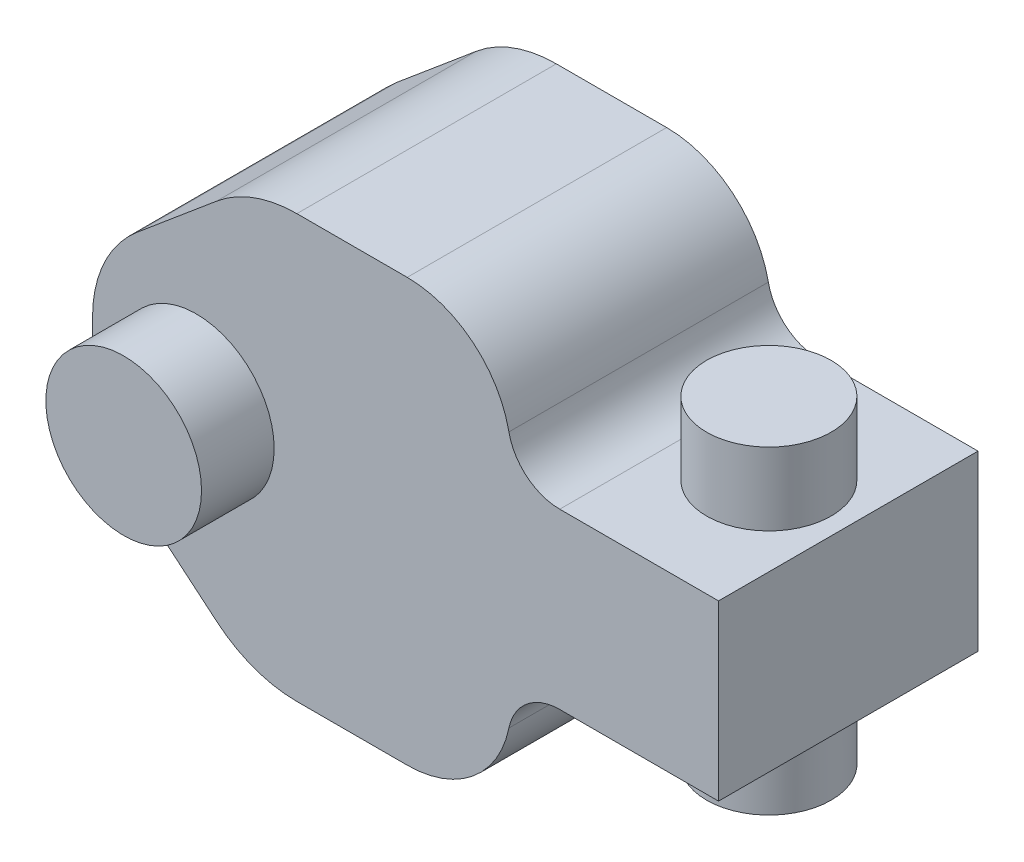
from build123d import *

# Parameters (mm, degrees)
SALIENTE_EXTRUIR1_DEPTH = 12.5
CROQUIS3_R              = 7.5
SALIENTE_EXTRUIR2_DEPTH = 19.5
CROQUIS4_W              = 20
CROQUIS4_H              = 25
CORTAR_EXTRUIR1_DEPTH   = 12
CROQUIS5_W              = 20
CROQUIS5_H              = 25
CORTAR_EXTRUIR2_DEPTH   = 12
REDONDEO1_R             = 10
REDONDEO2_R             = 5
CROQUIS7_R              = 6
SALIENTE_EXTRUIR4_DEPTH = 7
SALIENTE_EXTRUIR5_START = 7
CROQUIS8_R              = 6
SALIENTE_EXTRUIR5_DEPTH = 7


with BuildPart() as part:
    # Croquis1 → Saliente-Extruir1 (new, symmetric)
    with BuildSketch(Plane.XY):
        with BuildLine():
            Line((4.147680169, -1.57927741), (-36.48467702, -1.57927741))
            ThreePointArc((-36.48467702, -1.57927741), (-40.58891874, -2.30296596), (-44.198128336, -4.386744092))
            Line((-44.198128336, -4.386744092), (-51.88666001, -10.838188184))
            ThreePointArc((-51.88666001, -10.838188184), (-55.048902138, -14.95930236), (-56.173208693, -20.030721501))
            Line((-56.173208693, -20.030721501), (-56.173208693, -23.839337705))
            ThreePointArc((-56.173208693, -23.839337705), (-55.048902138, -28.910756846), (-51.88666001, -33.031871023))
            Line((-51.88666001, -33.031871023), (-44.198128336, -39.483315114))
            ThreePointArc((-44.198128336, -39.483315114), (-40.58891874, -41.567093246), (-36.48467702, -42.290781797))
            Line((-36.48467702, -42.290781797), (4.147680169, -42.290781797))
            Line((4.147680169, -42.290781797), (4.147680169, -1.57927741))
        make_face()
    extrude(amount=SALIENTE_EXTRUIR1_DEPTH, both=True)

    # Croquis3 → Saliente-Extruir2 (add, symmetric)
    with BuildSketch(Plane.XY):
        with Locations((-46.173208693, -22.290781797)):
            Circle(CROQUIS3_R)
    extrude(amount=SALIENTE_EXTRUIR2_DEPTH, both=True)

    # Croquis4 → Cortar-Extruir1 (cut)
    with BuildSketch(Plane(origin=(0, -1.57927741, 0), x_dir=(1, 0, 0), z_dir=(0, 1, 0))):
        with Locations((-5.852319831, 0)):
            Rectangle(CROQUIS4_W, CROQUIS4_H)
    extrude(amount=-CORTAR_EXTRUIR1_DEPTH, mode=Mode.SUBTRACT)

    # Croquis5 → Cortar-Extruir2 (cut)
    with BuildSketch(Plane.XZ.offset(42.290781797)):
        with Locations((-5.852319831, 0)):
            Rectangle(CROQUIS5_W, CROQUIS5_H)
    extrude(amount=-CORTAR_EXTRUIR2_DEPTH, mode=Mode.SUBTRACT)

    # Redondeo1
    redondeo1_edges = [part.edges().sort_by_distance(p)[0] for p in [
        (-15.852319831, -1.57927741, 0),
        (-15.852319831, -42.290781797, 0),
    ]]
    fillet(redondeo1_edges, radius=REDONDEO1_R)

    # Redondeo2
    redondeo2_edges = [part.edges().sort_by_distance(p)[0] for p in [
        (-15.852319831, -13.57927741, 0),
        (-15.852319831, -30.290781797, 0),
    ]]
    fillet(redondeo2_edges, radius=REDONDEO2_R)

    # Croquis7 → Saliente-Extruir4 (add)
    with BuildSketch(Plane(origin=(0, -13.57927741, 0), x_dir=(1, 0, 0), z_dir=(0, 1, 0))):
        with Locations(Location((-3.502319831, 0, 0), (0, 0, 180))):
            Circle(CROQUIS7_R)
    extrude(amount=SALIENTE_EXTRUIR4_DEPTH)

    # Croquis8 → Saliente-Extruir5 (add)
    with BuildSketch(Plane.XZ.offset(30.290781797).offset(SALIENTE_EXTRUIR5_START)):
        with Locations(Location((-3.502319831, 0, 0), (0, 0, 180))):
            Circle(CROQUIS8_R)
    extrude(amount=-SALIENTE_EXTRUIR5_DEPTH)


solid = part.part
